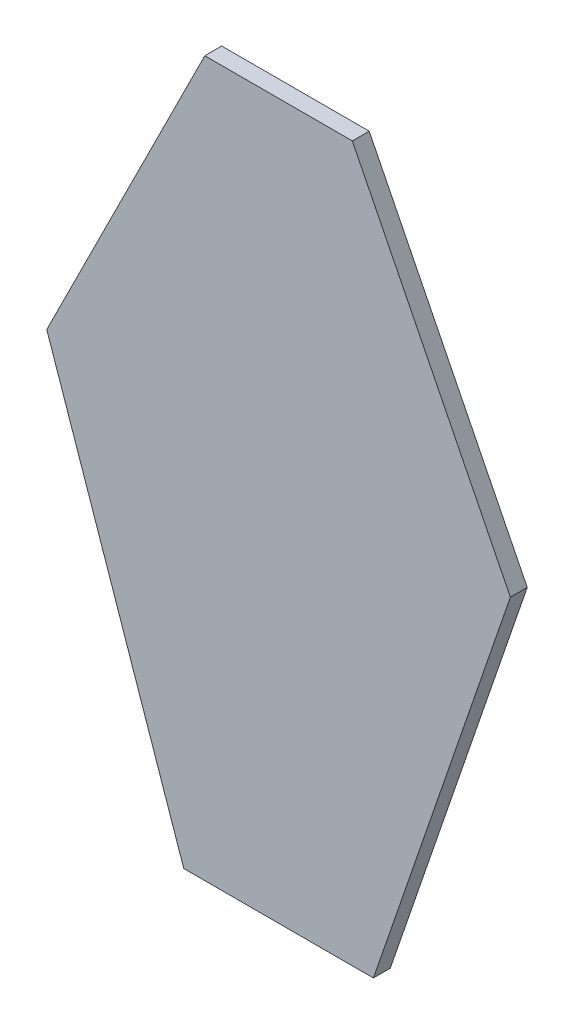
from build123d import *

# Parameters (mm, degrees)
EXTRUDE_815_DEPTH = 16


with BuildPart() as part:
    # 草图1 → Extrude 815 (new body)
    with BuildSketch(Plane.XY):
        Polygon((-70, 228), (70, 228), (220, -72), (90, -450), (-90, -450), (-220, -72), align=None)
    extrude(amount=EXTRUDE_815_DEPTH)


solid = part.part
